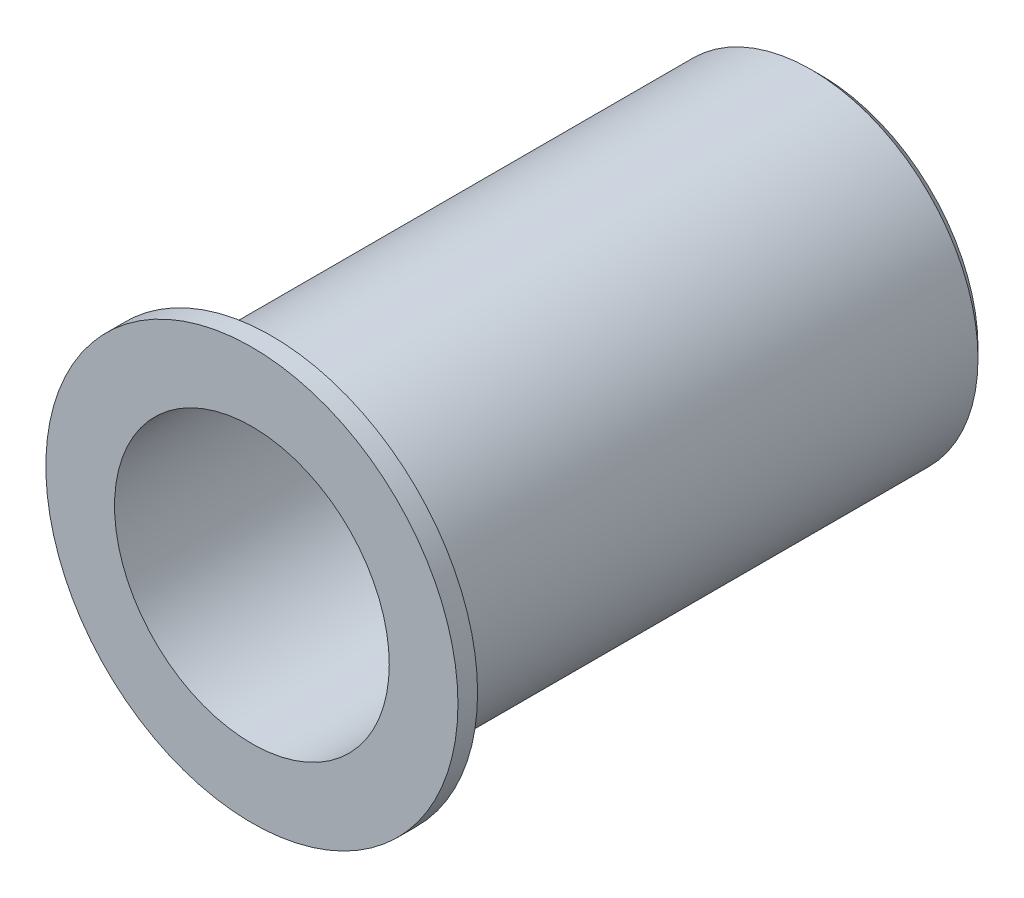
from build123d import *

# Parameters (mm, degrees)
SKETCH_1_R          = 8.5
EXTRUDE_1_DEPTH     = 28
SKETCH_2_R          = 7
CUT_EXTRUDE_3_DEPTH = 23
HOLE_WIZARD_M4_1_D  = 3.3
SKETCH_10_R         = 10.5
SKETCH_10_R_2       = 8.5
SKETCH_10_R_3       = 7
EXTRUDE_4_DEPTH     = 1
CHAMFER_1_SIZE      = 0.5


with BuildPart() as part:
    # 草图1 → 凸台-拉伸1 (new body)
    with BuildSketch(Plane.XY):
        Circle(SKETCH_1_R)
    extrude(amount=EXTRUDE_1_DEPTH)

    # 草图2 → 切除-拉伸3 (cut)
    with BuildSketch(Plane.XY.offset(28)):
        Circle(SKETCH_2_R)
    extrude(amount=-CUT_EXTRUDE_3_DEPTH, mode=Mode.SUBTRACT)

    # M4 螺纹孔1 (through all)
    with Locations(Plane(origin=(0, 0, 0), x_dir=(-1, 0, 0), z_dir=(0, 0, -1))):
        with Locations((0, 5), (0, 0), (-4.330127019, -2.5), (4.330127019, -2.5)):
            Hole(HOLE_WIZARD_M4_1_D / 2)

    # 草图10 → 凸台-拉伸4 (add)
    # profile 1 of 2: a face of its own
    with BuildSketch(Plane.XY.offset(28)):
        Circle(SKETCH_10_R)
        Circle(SKETCH_10_R_2, mode=Mode.SUBTRACT)
    # profile 2 of 2: a face of its own
    with BuildSketch(Plane.XY.offset(28)):
        Circle(SKETCH_10_R_2)
        Circle(SKETCH_10_R_3, mode=Mode.SUBTRACT)
    extrude(amount=EXTRUDE_4_DEPTH)

    # 倒角1
    chamfer_1_edges = [part.edges().sort_by_distance(p)[0] for p in [
        (-8.5, 0, 0),
    ]]
    chamfer(chamfer_1_edges, length=CHAMFER_1_SIZE)


solid = part.part
